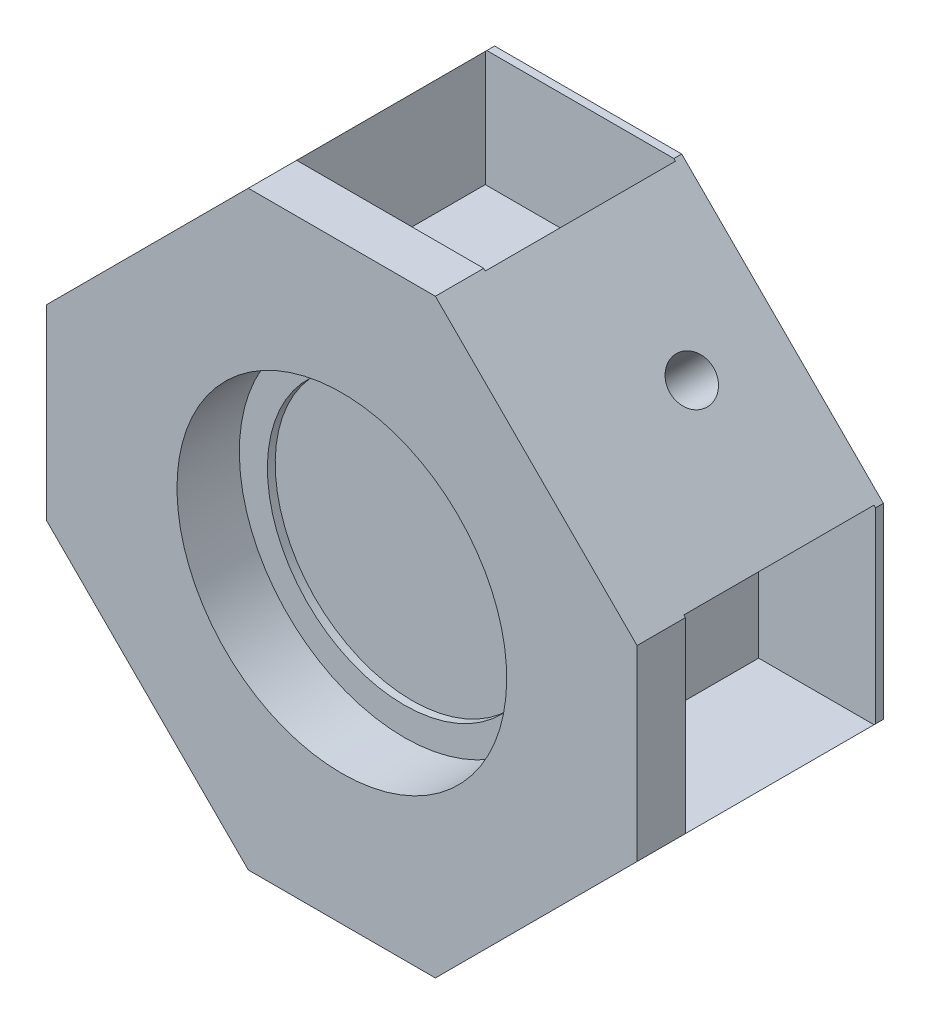
from build123d import *

# Parameters (mm, degrees)
SKIZZE1_W                          = 37.873435046
SKIZZE1_H                          = 37.873435047
AUFSATZ_LINEAR_AUSTRAGEN1_DEPTH    = 20
SKIZZE2_R                          = 10.575
SCHNITT_LINEAR_AUSTRAGEN1_DEPTH    = 4
SKIZZE3_W                          = 12
SKIZZE3_H                          = 12
SCHNITT_LINEAR_AUSTRAGEN3_DEPTH    = 7.5
VERRUNDUNG1_R                      = 8
KREISMUSTER1_COUNT                 = 4
SKIZZE4_R                          = 8.775
SCHNITT_LINEAR_AUSTRAGEN4_DEPTH    = 0.5
K_RPER_VERSCHIEBEN_KOPIEREN1_ANGLE = 90
SCHNITT_LINEAR_AUSTRAGEN5_DEPTH    = 44.118134258
SCHNITT_LINEAR_START               = -6
SKIZZE6_R                          = 1.4
SCHNITT_LINEAR_AUSTRAGEN6_DEPTH    = 16
KREISMUSTER2_COUNT                 = 4
SKIZZE7_W                          = 35.652729611
SKIZZE7_H                          = 9.373531579
SCHNITT_LINEAR_AUSTRAGEN8_DEPTH    = 51.066462265
SKIZZE8_W                          = 12.2
SKIZZE8_H                          = 12.2
SCHNITT_LINEAR_AUSTRAGEN9_DEPTH    = 7.5
KREISMUSTER11_COUNT                = 4


with BuildPart() as part:
    # Skizze1 → Aufsatz-Linear austragen1 (new body)
    with BuildSketch(Plane(origin=(0, 0, 0), x_dir=(1, 0, 0), z_dir=(0, 1, 0))):
        with Locations((6, 12.936717524)):
            Rectangle(SKIZZE1_W, SKIZZE1_H)
    extrude(amount=AUFSATZ_LINEAR_AUSTRAGEN1_DEPTH)

    # Skizze2 → Schnitt-Linear austragen1 (cut)
    with BuildSketch(Plane.XZ):
        with Locations(Location((6, -12.936717523, 0), (0, 0, 270))):
            Circle(SKIZZE2_R)
    extrude(amount=-SCHNITT_LINEAR_AUSTRAGEN1_DEPTH, mode=Mode.SUBTRACT)

    # Skizze3 → Schnitt-Linear austragen3 (cut)
    with BuildSketch(Plane.XY.offset(6)):
        with Locations((6, 9.2)):
            Rectangle(SKIZZE3_W, SKIZZE3_H)
    schnitt_linear_austragen3 = extrude(amount=-SCHNITT_LINEAR_AUSTRAGEN3_DEPTH, mode=Mode.SUBTRACT)

    # Verrundung1
    verrundung1_edges = [part.edges().sort_by_distance(p)[0] for p in [
        (24.936717523, 10, -31.873435047),
        (24.936717523, 10, 6),
        (-12.936717523, 10, 6),
        (-12.936717523, 10, -31.873435047),
    ]]
    fillet(verrundung1_edges, radius=VERRUNDUNG1_R)

    # Kreismuster1: Schnitt-Linear austragen3 ×4 about axis
    kreismuster1_axis = Axis((6, 0, -12.936717523), (0, 1, 0))
    for i in range(1, KREISMUSTER1_COUNT):
        add(schnitt_linear_austragen3.rotate(kreismuster1_axis, i * 360 / KREISMUSTER1_COUNT), mode=Mode.SUBTRACT)

    # Skizze4 → Schnitt-Linear austragen4 (cut)
    with BuildSketch(Plane.XZ.offset(-4)):
        with Locations(Location((6, -12.936717523, 0), (0, 0, 270))):
            Circle(SKIZZE4_R)
    extrude(amount=-SCHNITT_LINEAR_AUSTRAGEN4_DEPTH, mode=Mode.SUBTRACT)


with BuildPart() as part_1:
    # Körper-Verschieben/Kopieren1: moved
    add(part.part.rotate(Axis((0, 10, -12.936717523), (-1, 0, 0)), K_RPER_VERSCHIEBEN_KOPIEREN1_ANGLE))

    # Skizze5 → Schnitt-Linear austragen5 (cut, through all)
    with BuildSketch(Plane.XY.offset(-2.936717523)):
        Polygon((0, 28.936717523), (-12.936717523, 16), (-12.936717523, 28.936717523), align=None)
        Polygon((24.936717523, 16), (24.936717523, 28.936717523), (12, 28.936717523), align=None)
        Polygon((12, -8.936717523), (24.936717523, 4), (24.936717523, -8.936717523), align=None)
        Polygon((-12.936717523, -8.936717523), (0, -8.936717523), (-12.936717523, 4), align=None)
    extrude(amount=-SCHNITT_LINEAR_AUSTRAGEN5_DEPTH, mode=Mode.SUBTRACT)

    # Skizze6 → Schnitt-Linear austragen6 (cut)
    with BuildSketch(Plane(origin=(-14.468358762, 14.468358762, 0), x_dir=(0.7071067811865559, 0.7071067811865392, 0), z_dir=(-0.7071067811865392, 0.7071067811865559, 0)).offset(SCHNITT_LINEAR_START)):
        with Locations((11.284238529, 12.936717523)):
            Circle(SKIZZE6_R)
    schnitt_linear_austragen6 = extrude(amount=SCHNITT_LINEAR_AUSTRAGEN6_DEPTH, mode=Mode.SUBTRACT)

    # Kreismuster2: Schnitt-Linear austragen6 ×4 about axis
    kreismuster2_axis = Axis((6, 10, 0), (0, 0, 1))
    for i in range(1, KREISMUSTER2_COUNT):
        add(schnitt_linear_austragen6.rotate(kreismuster2_axis, i * 360 / KREISMUSTER2_COUNT), mode=Mode.SUBTRACT)

    # Skizze7 → Schnitt-Linear austragen8 (cut, through all)
    with BuildSketch(Plane(origin=(20.468358762, 20.468358762, 0), x_dir=(0.7071067811865558, -0.7071067811865392, 0), z_dir=(0.7071067811865392, 0.7071067811865558, 0))):
        with Locations((-3.021869868, 23.423483313)):
            Rectangle(SKIZZE7_W, SKIZZE7_H)
    extrude(amount=-SCHNITT_LINEAR_AUSTRAGEN8_DEPTH, mode=Mode.SUBTRACT)

    # Skizze8 → Schnitt-Linear austragen9 (cut)
    with BuildSketch(Plane.ZY.offset(12.936717523)):
        with Locations((-12.136717523, 10)):
            Rectangle(SKIZZE8_W, SKIZZE8_H)
    schnitt_linear_austragen9 = extrude(amount=-SCHNITT_LINEAR_AUSTRAGEN9_DEPTH, mode=Mode.SUBTRACT)

    # Kreismuster11: Schnitt-Linear austragen9 ×4 about axis
    kreismuster11_axis = Axis((6, 10, 0), (0, 0, 1))
    for i in range(1, KREISMUSTER11_COUNT):
        add(schnitt_linear_austragen9.rotate(kreismuster11_axis, i * 360 / KREISMUSTER11_COUNT), mode=Mode.SUBTRACT)


solid = part_1.part
